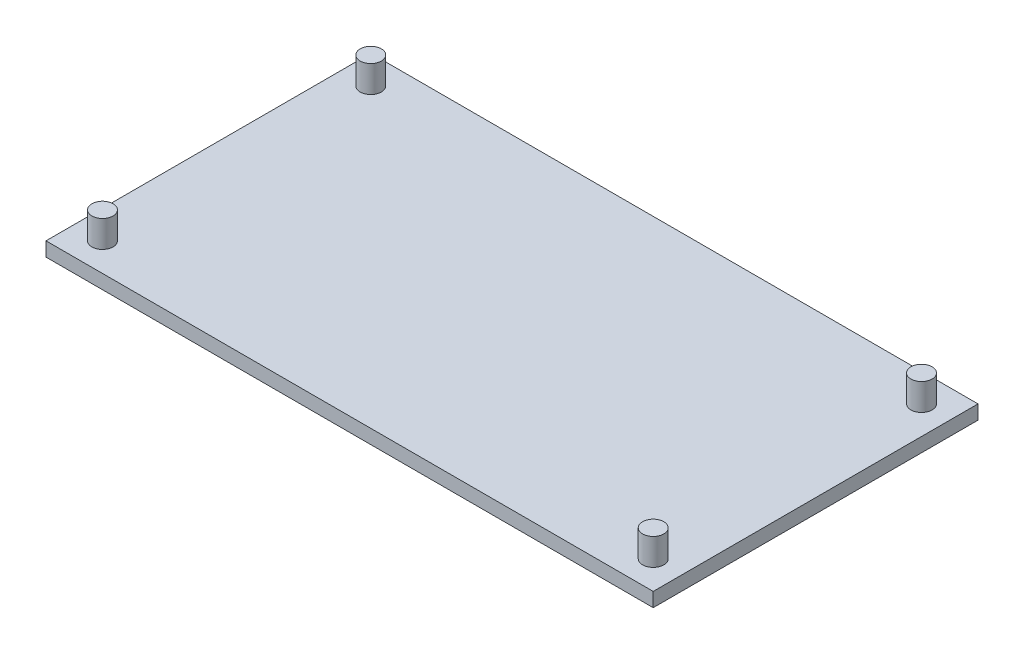
from build123d import *

# Parameters (mm, degrees)
SKETCH_1_W      = 86
SKETCH_1_H      = 46
EXTRUDE_1_DEPTH = 2
SKETCH_2_R      = 1.5
EXTRUDE_2_DEPTH = 5.8


with BuildPart() as part:
    # 草图1 → 凸台-拉伸1 (new body)
    with BuildSketch(Plane(origin=(0, 0, 0), x_dir=(1, 0, 0), z_dir=(0, 1, 0))):
        Rectangle(SKETCH_1_W, SKETCH_1_H)
    extrude(amount=EXTRUDE_1_DEPTH)

    # 草图2 → 凸台-拉伸2 (add)
    with BuildSketch(Plane.XZ):
        with Locations(Location((-39, 19, 0), (0, 0, 270))):
            Circle(SKETCH_2_R)
        with Locations(Location((-39, -19, 0), (0, 0, 270))):
            Circle(SKETCH_2_R)
        with Locations(Location((39, 19, 0), (0, 0, 270))):
            Circle(SKETCH_2_R)
        with Locations(Location((39, -19, 0), (0, 0, 270))):
            Circle(SKETCH_2_R)
    extrude(amount=-EXTRUDE_2_DEPTH)


solid = part.part
